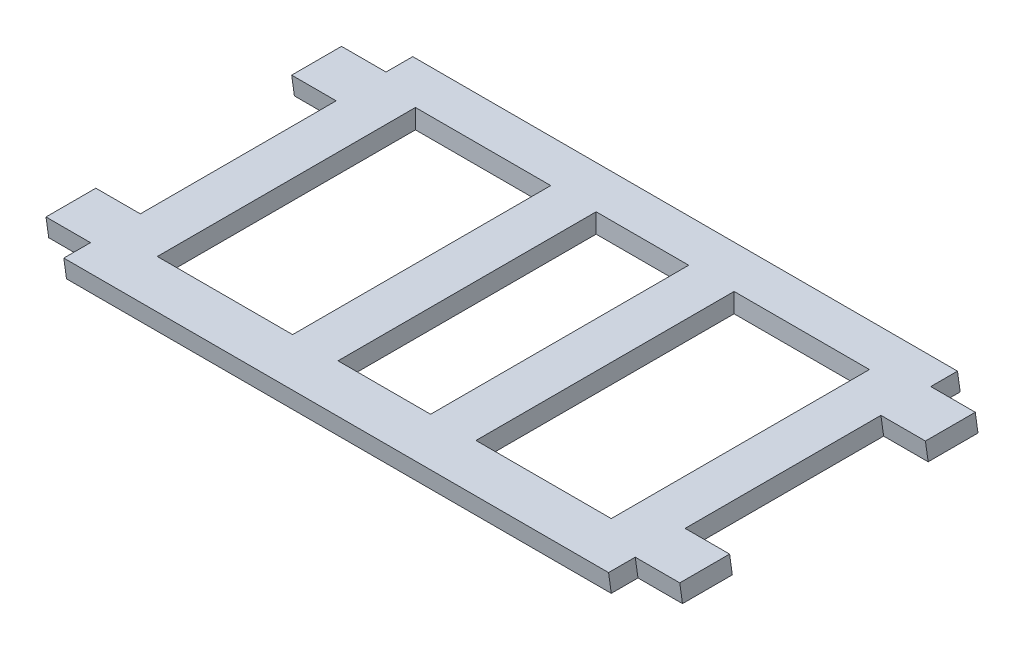
from build123d import *

# Parameters (mm, degrees)
SKETCH4_W          = 13.208
SKETCH4_H          = 36.83
SKETCH4_W_2        = 19.304
CUT_EXTRUDE1_DEPTH = 7.62


with BuildPart() as part:
    # Sketch1 → Loft1 section 0
    with BuildSketch(Plane(origin=(0, 0, 0), x_dir=(1, 0, 0), z_dir=(0, 1, 0))):
        with BuildLine():
            Line((0, 7.112), (6.35, 7.112))
            Line((6.35, 7.112), (6.35, 35.052))
            Line((6.35, 35.052), (0, 35.052))
            Line((0, 35.052), (0, 42.164))
            Line((0, 42.164), (6.35, 42.164))
            Line((6.35, 42.164), (6.35, 45.974))
            Line((6.35, 45.974), (84.074, 45.974))
            Line((84.074, 45.974), (84.074, 42.164))
            Line((84.074, 42.164), (90.424, 42.164))
            Line((90.424, 42.164), (90.424, 35.052))
            Line((90.424, 35.052), (84.074, 35.052))
            Line((84.074, 35.052), (84.074, 7.112))
            Line((84.074, 7.112), (90.424, 7.112))
            Line((90.424, 7.112), (90.424, 0))
            Line((90.424, 0), (84.074, 0))
            Line((84.074, 0), (84.074, -3.81))
            Line((84.074, -3.81), (6.35, -3.81))
            Line((6.35, -3.81), (6.35, 0))
            Line((6.35, 0), (0, 0))
            Line((0, 0), (0, 7.112))
        make_face()
    # Sketch2 → Loft1 section 1
    with BuildSketch(Plane(origin=(0, 2.7667966, 0), x_dir=(1, 0, 0), z_dir=(0, 1, 0))):
        with BuildLine():
            Line((90.424, -0.3888486), (90.424, 6.7231514))
            Line((90.424, 6.7231514), (84.074, 6.7231514))
            Line((84.074, 6.7231514), (84.074, 34.6631514))
            Line((84.074, 34.6631514), (90.424, 34.6631514))
            Line((90.424, 34.6631514), (90.424, 41.7751514))
            Line((90.424, 41.7751514), (84.074, 41.7751514))
            Line((84.074, 41.7751514), (84.074, 45.5851514))
            Line((84.074, 45.5851514), (6.35, 45.5851514))
            Line((6.35, 45.5851514), (6.35, 41.7751514))
            Line((6.35, 41.7751514), (0, 41.7751514))
            Line((0, 41.7751514), (0, 34.6631514))
            Line((0, 34.6631514), (6.35, 34.6631514))
            Line((6.35, 34.6631514), (6.35, 6.7231514))
            Line((6.35, 6.7231514), (0, 6.7231514))
            Line((0, 6.7231514), (0, -0.3888486))
            Line((0, -0.3888486), (6.35, -0.3888486))
            Line((6.35, -0.3888486), (6.35, -4.1988486))
            Line((6.35, -4.1988486), (84.074, -4.1988486))
            Line((84.074, -4.1988486), (84.074, -0.3888486))
            Line((84.074, -0.3888486), (90.424, -0.3888486))
        make_face()
    loft()

    # Sketch4 → Cut-Extrude1 (cut)
    with BuildSketch(Plane(origin=(0, 2.7667966, 0), x_dir=(1, 0, 0), z_dir=(0, 1, 0))):
        with Locations((45.212, 21.082)):
            Rectangle(SKETCH4_W, SKETCH4_H)
        with Locations((22.479, 21.082)):
            Rectangle(SKETCH4_W_2, SKETCH4_H)
        with Locations((67.945, 21.082)):
            Rectangle(SKETCH4_W_2, SKETCH4_H)
    extrude(amount=-CUT_EXTRUDE1_DEPTH, mode=Mode.SUBTRACT)


solid = part.part
